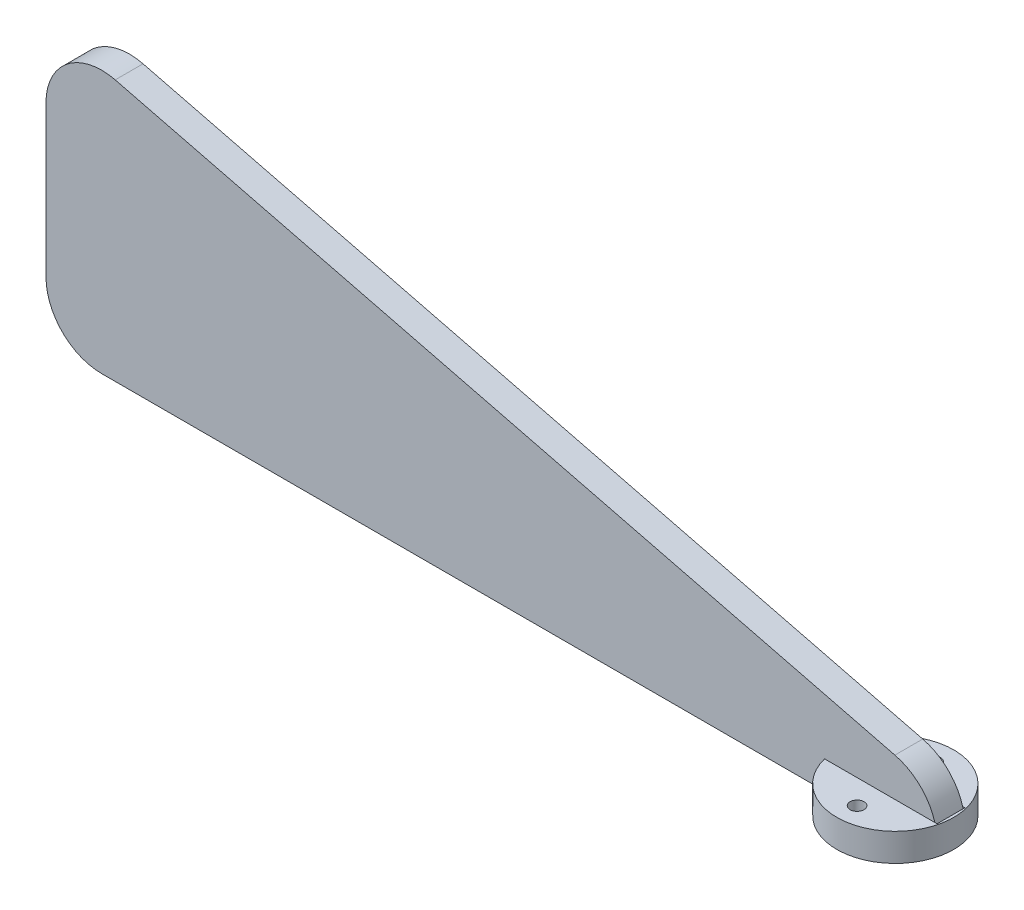
from build123d import *

# Parameters (mm, degrees)
EXTRUDE_1_DEPTH = 5
SKETCH_2_R      = 1.25
EXTRUDE_4_DEPTH = 5


with BuildPart() as part:
    # 스케치1 → 보스-돌출1 (new body)
    with BuildSketch(Plane.XY):
        with BuildLine():
            Line((0, 10), (0, 37.192235936))
            ThreePointArc((0, 37.192235936), (3.845877906, 45.074290316), (12.42535625, 46.893660937))
            Line((12.42535625, 46.893660937), (152.42535625, 11.893660937))
            ThreePointArc((152.42535625, 11.893660937), (157.88205438, 8.34635803), (160, 2.192235936))
            Line((160, 2.192235936), (160, 0))
            Line((160, 0), (10, 0))
            ThreePointArc((10, 0), (2.928932188, 2.928932188), (0, 10))
        make_face()
    extrude(amount=EXTRUDE_1_DEPTH)

    # 스케치2 → 보스-돌출4 (add)
    with BuildSketch(Plane.XZ):
        with BuildLine():
            Line((150, 0), (139.801960973, 0))
            ThreePointArc((139.801960973, 0), (151.259085028, -7.924236418), (160.5, 2.5))
            ThreePointArc((160.5, 2.5), (151.259085028, 12.924236418), (139.801960973, 5))
            Line((139.801960973, 5), (150, 5))
            Line((150, 5), (160, 5))
            Line((160, 5), (160, 0))
            Line((160, 0), (150, 0))
        make_face()
        with Locations(Location((150, -4.37, 0), (0, 0, 270))):
            Circle(SKETCH_2_R, mode=Mode.SUBTRACT)
        with Locations(Location((150, 9.37, 0), (0, 0, 270))):
            Circle(SKETCH_2_R, mode=Mode.SUBTRACT)
    extrude(amount=-EXTRUDE_4_DEPTH)


solid = part.part
